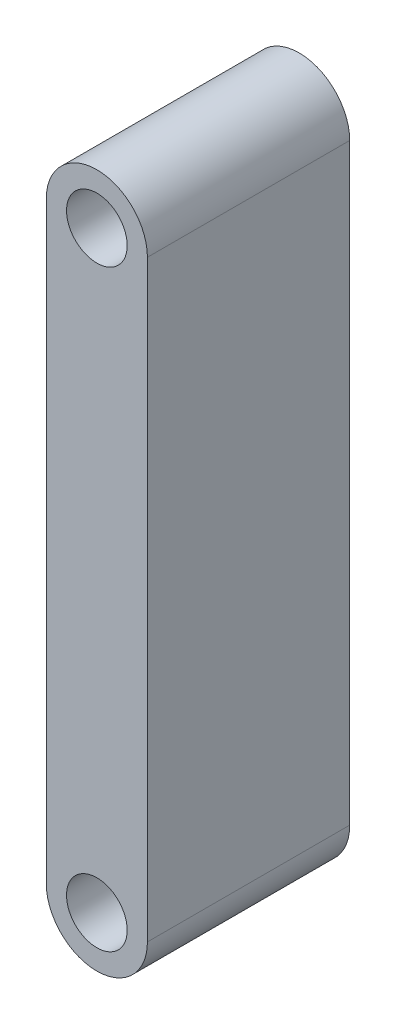
from build123d import *

# Parameters (mm, degrees)
SCHIZZO2_R                   = 15
ESTRUSIONE_ESTRUSIONE1_DEPTH = 50


with BuildPart() as part:
    # Schizzo2 → Estrusione-Estrusione1 (new, symmetric)
    with BuildSketch(Plane.XY):
        with BuildLine():
            Line((25, 253.456382451), (25, -39.643617549))
            ThreePointArc((25, -39.643617549), (0, -64.643617549), (-25, -39.643617549))
            Line((-25, -39.643617549), (-25, 253.456382451))
            ThreePointArc((-25, 253.456382451), (0, 278.456382451), (25, 253.456382451))
        make_face()
        with Locations((0, 253.456382451)):
            Circle(SCHIZZO2_R, mode=Mode.SUBTRACT)
        with Locations((0, -39.643617549)):
            Circle(SCHIZZO2_R, mode=Mode.SUBTRACT)
    extrude(amount=ESTRUSIONE_ESTRUSIONE1_DEPTH, both=True)


solid = part.part
